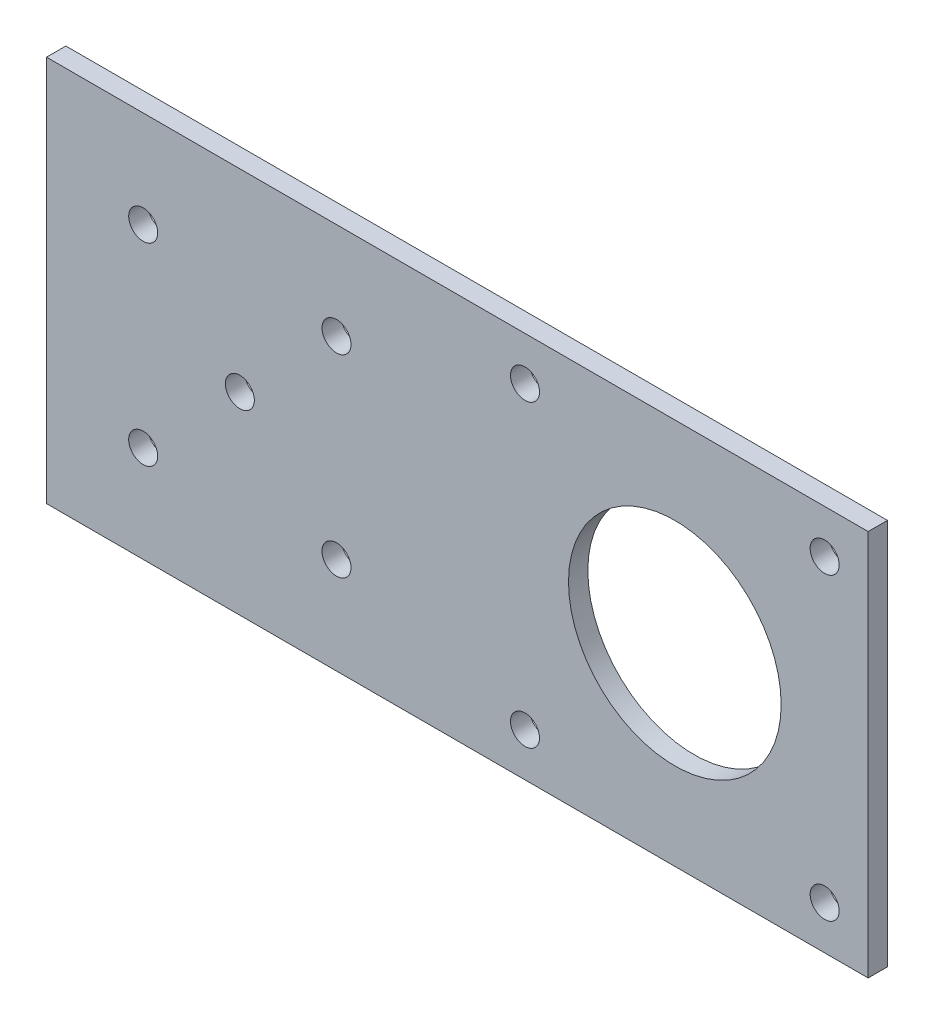
from build123d import *

# Parameters (mm, degrees)
SKETCH1_W           = 85
SKETCH1_H           = 40
BOSS_EXTRUDE1_DEPTH = 1
SKETCH2_R           = 11
SKETCH2_R_2         = 1.5
CUT_EXTRUDE1_DEPTH  = 2
SKETCH3_R           = 1.5
CUT_EXTRUDE2_DEPTH  = 10


with BuildPart() as part:
    # Sketch1 → Boss-Extrude1 (new, symmetric)
    with BuildSketch(Plane.XY):
        Rectangle(SKETCH1_W, SKETCH1_H)
    extrude(amount=BOSS_EXTRUDE1_DEPTH, both=True)

    # Sketch2 → Cut-Extrude1 (cut)
    with BuildSketch(Plane.XY.offset(1)):
        with Locations((22.5, 0)):
            Circle(SKETCH2_R)
        with Locations((-22.5, 0)):
            Circle(SKETCH2_R_2)
        with Locations((-32.5, 10)):
            Circle(SKETCH2_R_2)
        with Locations((-12.5, 10)):
            Circle(SKETCH2_R_2)
        with Locations((-12.5, -10)):
            Circle(SKETCH2_R_2)
        with Locations((-32.5, -10)):
            Circle(SKETCH2_R_2)
    extrude(amount=-CUT_EXTRUDE1_DEPTH, mode=Mode.SUBTRACT)

    # Sketch3 → Cut-Extrude2 (cut)
    with BuildSketch(Plane.XY.offset(1)):
        with Locations((7, 15.5)):
            Circle(SKETCH3_R)
        with Locations((38, 15.5)):
            Circle(SKETCH3_R)
        with Locations((38, -15.5)):
            Circle(SKETCH3_R)
        with Locations((7, -15.5)):
            Circle(SKETCH3_R)
    extrude(amount=-CUT_EXTRUDE2_DEPTH, mode=Mode.SUBTRACT)


solid = part.part
